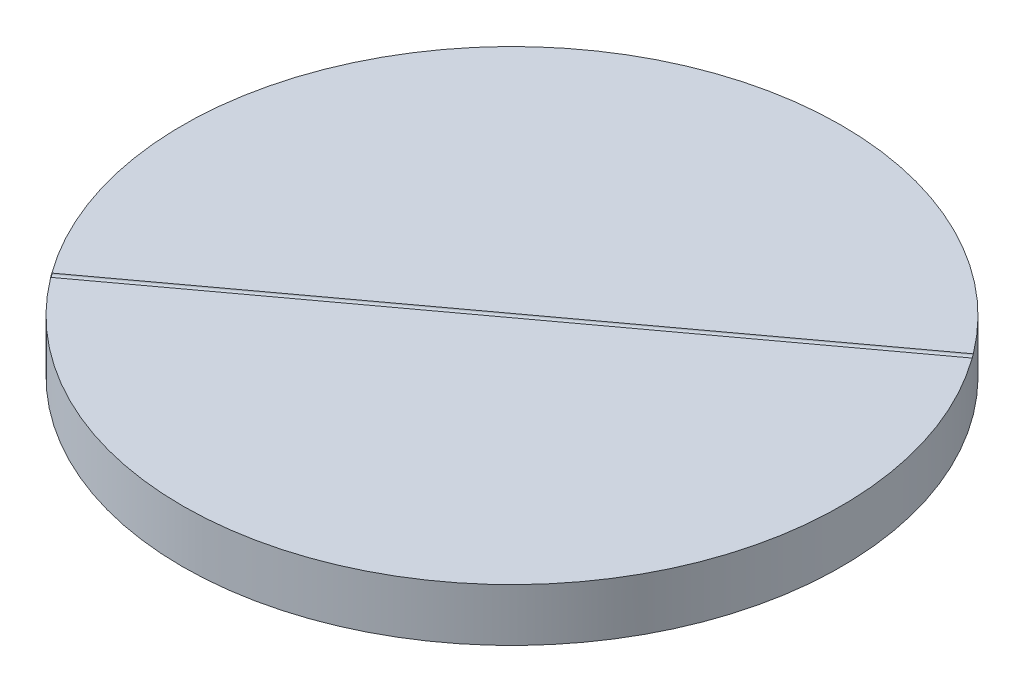
from build123d import *

# Parameters (mm, degrees)
SKETCH1_R           = 3.175
BOSS_EXTRUDE1_DEPTH = 0.508
CUT_REVOLVE1_ANGLE  = 180


with BuildPart() as part:
    # Sketch1 → Boss-Extrude1 (new body)
    with BuildSketch(Plane(origin=(0, 0, 0), x_dir=(1, 0, 0), z_dir=(0, 1, 0))):
        with Locations(Location((0, 0, 0), (0, 0, 270))):
            Circle(SKETCH1_R)
    extrude(amount=BOSS_EXTRUDE1_DEPTH)

    # Sketch2 → Cut-Revolve1 (revolve, cut)
    with BuildSketch(Plane(origin=(0, 0.508, 0), x_dir=(1, 0, 0), z_dir=(0, 1, 0))):
        Polygon((-2.556490895, -1.882811542), (2.556490895, 1.882811542), (2.571471578, 1.862299364), (-2.541346594, -1.903203218), align=None)
    revolve(axis=Axis((-2.556490895, 0.508, 1.882811542), (0.8051939826990212, 0, -0.5930115093531394)), revolution_arc=CUT_REVOLVE1_ANGLE, mode=Mode.SUBTRACT)


solid = part.part
